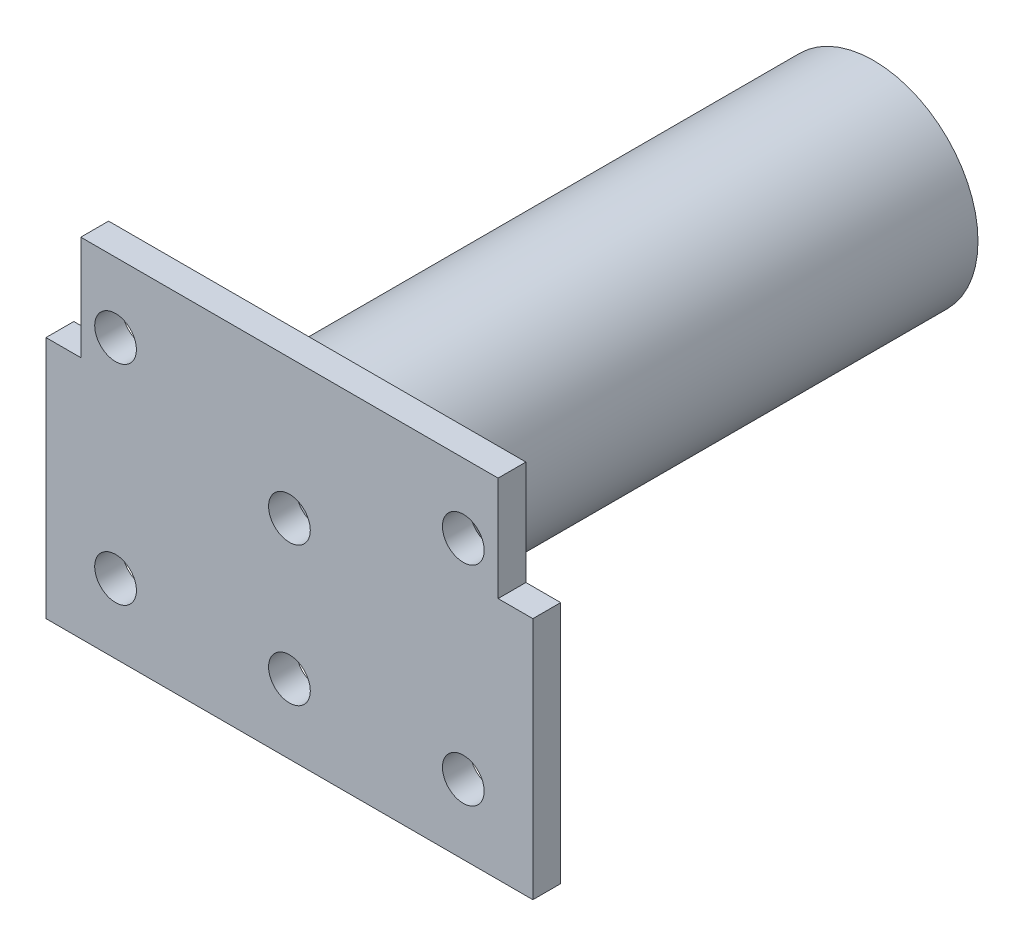
from build123d import *

# Parameters (mm, degrees)
CROQUIS1_W              = 70
CROQUIS1_H              = 30
CROQUIS1_R              = 3
SALIENTE_EXTRUIR1_DEPTH = 4
CROQUIS3_W              = 70
CROQUIS3_H              = 20
SALIENTE_EXTRUIR2_DEPTH = 4
CROQUIS4_R              = 15
SALIENTE_EXTRUIR3_DEPTH = 80
CROQUIS5_R              = 3
CORTAR_EXTRUIR1_DEPTH   = 4
CROQUIS7_R              = 13.5
CORTAR_EXTRUIR2_DEPTH   = 80
CROQUIS6_R              = 3
CORTAR_EXTRUIR3_DEPTH   = 4
CROQUIS8_W              = 5
CROQUIS8_H              = 15
CORTAR_EXTRUIR4_DEPTH   = 4


with BuildPart() as part:
    # Croquis1 → Saliente-Extruir1 (new body)
    with BuildSketch(Plane.XY):
        Rectangle(CROQUIS1_W, CROQUIS1_H)
        with Locations((0, -5)):
            Circle(CROQUIS1_R, mode=Mode.SUBTRACT)
        with Locations((25, -5)):
            Circle(CROQUIS1_R, mode=Mode.SUBTRACT)
        with Locations((-25, -5)):
            Circle(CROQUIS1_R, mode=Mode.SUBTRACT)
    extrude(amount=SALIENTE_EXTRUIR1_DEPTH)

    # Croquis3 → Saliente-Extruir2 (add)
    with BuildSketch(Plane.XY):
        with Locations((0, 25)):
            Rectangle(CROQUIS3_W, CROQUIS3_H)
    extrude(amount=SALIENTE_EXTRUIR2_DEPTH)

    # Croquis4 → Saliente-Extruir3 (add)
    with BuildSketch(Plane(origin=(0, 0, 0), x_dir=(-1, 0, 0), z_dir=(0, 0, -1))):
        with Locations((0, 15)):
            Circle(CROQUIS4_R)
    extrude(amount=SALIENTE_EXTRUIR3_DEPTH)

    # Croquis5 → Cortar-Extruir1 (cut)
    with BuildSketch(Plane(origin=(0, 0, 0), x_dir=(-1, 0, 0), z_dir=(0, 0, -1))):
        with Locations((-25, 25)):
            Circle(CROQUIS5_R)
        with Locations((25, 25)):
            Circle(CROQUIS5_R)
    extrude(amount=-CORTAR_EXTRUIR1_DEPTH, mode=Mode.SUBTRACT)

    # Croquis7 → Cortar-Extruir2 (cut)
    with BuildSketch(Plane(origin=(0, 0, -80), x_dir=(-1, 0, 0), z_dir=(0, 0, -1))):
        with Locations((0, 15)):
            Circle(CROQUIS7_R)
    extrude(amount=-CORTAR_EXTRUIR2_DEPTH, mode=Mode.SUBTRACT)

    # Croquis6 → Cortar-Extruir3 (cut)
    with BuildSketch(Plane.XY.offset(4)):
        with Locations((0, 15)):
            Circle(CROQUIS6_R)
    extrude(amount=-CORTAR_EXTRUIR3_DEPTH, mode=Mode.SUBTRACT)

    # Croquis8 → Cortar-Extruir4 (cut)
    with BuildSketch(Plane(origin=(0, 0, 0), x_dir=(-1, 0, 0), z_dir=(0, 0, -1))):
        with Locations((-32.5, 27.5)):
            Rectangle(CROQUIS8_W, CROQUIS8_H)
        with Locations((32.5, 27.5)):
            Rectangle(CROQUIS8_W, CROQUIS8_H)
    extrude(amount=-CORTAR_EXTRUIR4_DEPTH, mode=Mode.SUBTRACT)


solid = part.part
